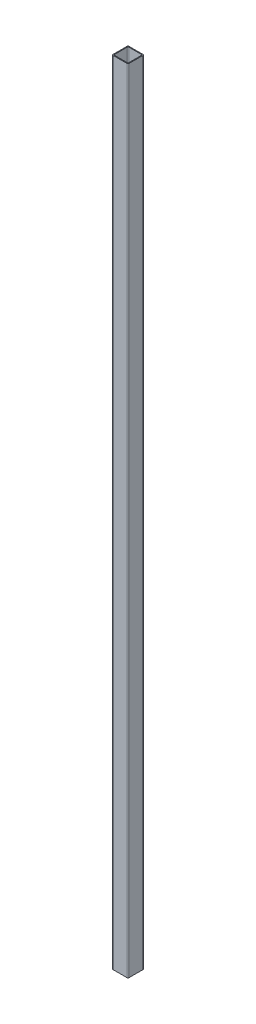
from build123d import *

# Parameters (mm, degrees)
EXTRUDE_1_DEPTH = 2000


with BuildPart() as part:
    # Эскиз2 → Бобышка-Вытянуть1 (new body)
    with BuildSketch(Plane(origin=(0, 0, 0), x_dir=(1, 0, 0), z_dir=(0, 1, 0))):
        with BuildLine():
            Line((-18, 20), (18, 20))
            ThreePointArc((18, 20), (19.414213562, 19.414213562), (20, 18))
            Line((20, 18), (20, -18))
            ThreePointArc((20, -18), (19.414213562, -19.414213562), (18, -20))
            Line((18, -20), (-18, -20))
            ThreePointArc((-18, -20), (-19.414213562, -19.414213562), (-20, -18))
            Line((-20, -18), (-20, 18))
            ThreePointArc((-20, 18), (-19.414213562, 19.414213562), (-18, 20))
        make_face()
        with BuildLine():
            Line((16, -18), (-16, -18))
            ThreePointArc((-16, -18), (-17.414213562, -17.414213562), (-18, -16))
            Line((-18, -16), (-18, 16))
            ThreePointArc((-18, 16), (-17.414213562, 17.414213562), (-16, 18))
            Line((-16, 18), (16, 18))
            ThreePointArc((16, 18), (17.414213562, 17.414213562), (18, 16))
            Line((18, 16), (18, -16))
            ThreePointArc((18, -16), (17.414213562, -17.414213562), (16, -18))
        make_face(mode=Mode.SUBTRACT)
    extrude(amount=EXTRUDE_1_DEPTH)


solid = part.part
